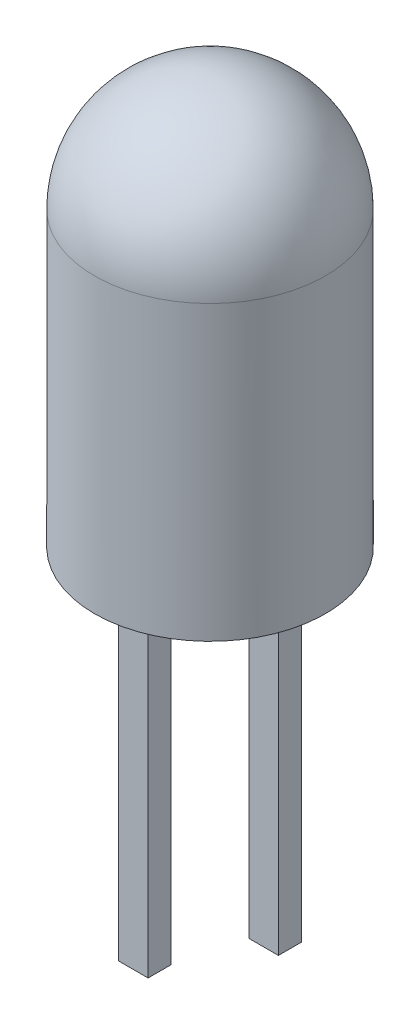
from build123d import *

# Parameters (mm, degrees)
SKETCH3_W             = 0.383062026
SKETCH3_H             = 0.298484562
BOSS_EXTRUDE1_DEPTH   = 4
BOSS_EXTRUDE1_2_DEPTH = 4
BOSS_EXTRUDE2_DEPTH   = 0.15
SKETCH5_R             = 0.189425794
BOSS_EXTRUDE3_DEPTH   = 0.1
SKETCH7_W             = 0.383062026
SKETCH7_H             = 0.298484562
BOSS_EXTRUDE5_DEPTH   = 1.1


with BuildPart() as part:
    # Sketch1 → Revolve1 (revolve)
    with BuildSketch(Plane.XY, mode=Mode.PRIVATE) as revolve1_sk:
        with BuildLine():
            Line((0, 0), (-1.5, 0))
            Line((-1.5, 0), (-1.5, 3.8))
            ThreePointArc((-1.5, 3.8), (-1.060660172, 4.860660172), (0, 5.3))
            Line((0, 5.3), (0, 0))
        make_face()
    revolve(revolve1_sk.sketch.rotate(Axis((0, 0, 0), (0, 1, 0)), 270), axis=Axis((0, 0, 0), (0, 1, 0)))


with BuildPart() as body_2:
    # Sketch3 → Boss-Extrude1 (new body)
    with BuildSketch(Plane.XZ):
        with Locations((-0.846347528, 0)):
            Rectangle(SKETCH3_W, SKETCH3_H)
    extrude(amount=BOSS_EXTRUDE1_DEPTH)


with BuildPart() as body_3:
    # Sketch3 → Boss-Extrude1 2 (new body)
    with BuildSketch(Plane.XZ):
        with Locations((0.846347528, 0)):
            Rectangle(SKETCH3_W, SKETCH3_H)
    extrude(amount=BOSS_EXTRUDE1_2_DEPTH)


    add(body_2.part)  # Boss-Extrude2 merges body 2
    # Sketch4 → Boss-Extrude2 (add, symmetric)
    with BuildSketch(Plane.XY):
        Polygon((1.037878541, 2.260445566), (0.294117621, 2.788795467), (0.235969658, 2.706940276), (-0.385685641, 2.706940276), (-0.512741887, 2.796720697), (-0.565939225, 2.796720697), (-0.565939225, 2.617159855), (-0.565939225, 2.418450997), (0.654816515, 1.551255429), (0.654816515, 0), (1.037878541, 0), (1.037878541, 1.551255429), align=None)
        Polygon((0.482142428, 1.551255429), (-0.665939225, 2.366825071), (-0.665939225, 2.617159855), (-1.037878541, 2.617159855), (-1.037878541, 1.551255429), (-1.037878541, 0), (-0.654816515, 0), (-0.654816515, 1.551255429), align=None)
    extrude(amount=BOSS_EXTRUDE2_DEPTH, both=True)

    # Sketch7 → Boss-Extrude5 (add)
    with BuildSketch(Plane.XZ.offset(4)):
        with Locations((-0.846347528, 0)):
            Rectangle(SKETCH7_W, SKETCH7_H)
    extrude(amount=BOSS_EXTRUDE5_DEPTH)


with BuildPart() as body_3_2:
    # Sketch5 → Boss-Extrude3 (new body)
    with BuildSketch(Plane(origin=(0, 2.706940276, 0), x_dir=(1, 0, 0), z_dir=(0, 1, 0))):
        with Locations(Location((-0.060559566, 0, 0), (0, 0, 180))):
            Circle(SKETCH5_R)
    extrude(amount=BOSS_EXTRUDE3_DEPTH)


solid = Compound([part.part, body_3.part, body_3_2.part])
